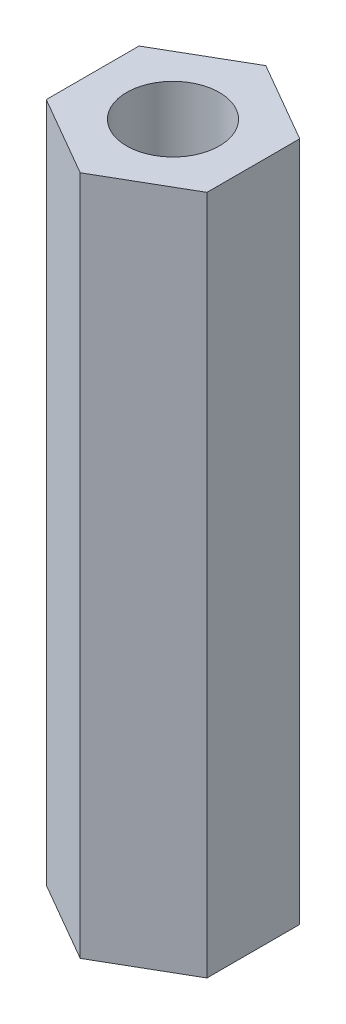
from build123d import *

# Parameters (mm, degrees)
SKETCH_1_R      = 1.5
EXTRUDE_1_DEPTH = 22


with BuildPart() as part:
    # Эскиз1 → Бобышка-Вытянуть1 (new body)
    with BuildSketch(Plane(origin=(0, 0, 0), x_dir=(1, 0, 0), z_dir=(0, 1, 0))):
        Polygon((-2.598076211, -1.5), (0, -3), (2.598076211, -1.5), (2.598076211, 1.5), (0, 3), (-2.598076211, 1.5), align=None)
        with Locations(Location((0, 0, 0), (0, 0, 270))):
            Circle(SKETCH_1_R, mode=Mode.SUBTRACT)
    extrude(amount=EXTRUDE_1_DEPTH)


solid = part.part
